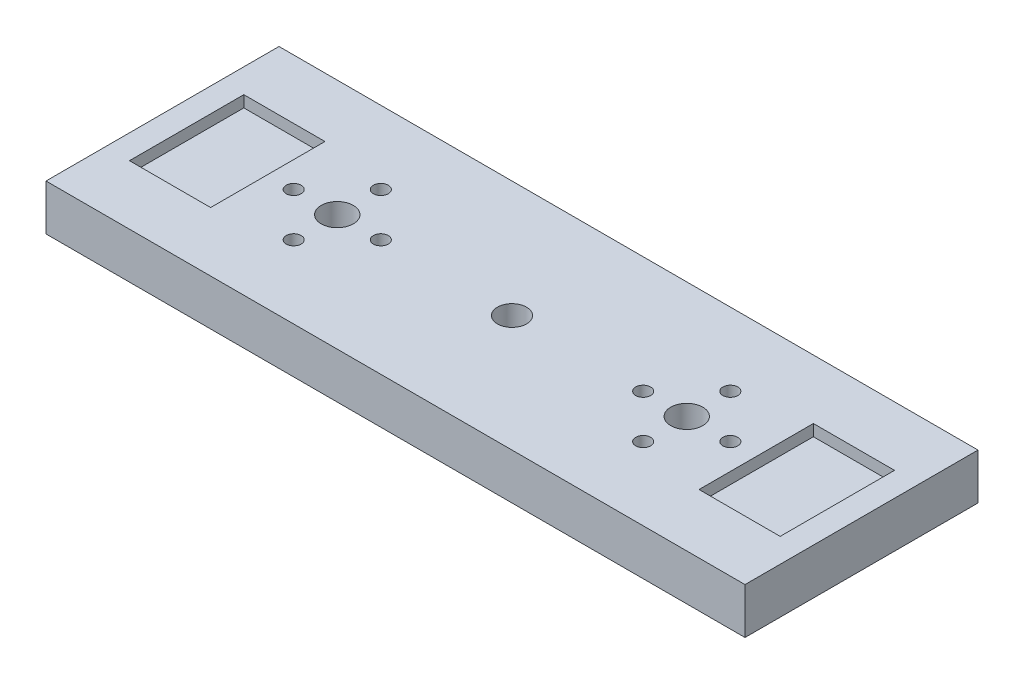
from build123d import *

# Parameters (mm, degrees)
SKETCH2_W                 = 304.8
SKETCH2_H                 = 101.6
SKETCH2_R                 = 6.35
SKETCH2_R_2               = 7
BOSS_EXTRUDE1_DEPTH       = 20
SKETCH3_R                 = 3.25
CUT_EXTRUDE1_DEPTH        = 162.883909021
CIRPATTERN1_COUNT         = 4
LPATTERN1_COUNT           = 2
LPATTERN1_PITCH           = 152.4
LPATTERN1_COPY_1_SKETCH_R = 3.25
LPATTERN1_COPY_1_DEPTH    = 162.883909021
LPATTERN1_COPY_2_SKETCH_R = 3.25
LPATTERN1_COPY_2_DEPTH    = 162.883909021
LPATTERN1_COPY_3_SKETCH_R = 3.25
LPATTERN1_COPY_3_DEPTH    = 162.883909021
SKETCH4_W                 = 35.387760229
SKETCH4_H                 = 49.864571232
CUT_EXTRUDE2_DEPTH        = 5


with BuildPart() as part:
    # Sketch2 → Boss-Extrude1 (new body)
    with BuildSketch(Plane(origin=(0, 0, 0), x_dir=(1, 0, 0), z_dir=(0, 1, 0))):
        Rectangle(SKETCH2_W, SKETCH2_H)
        with Locations(Location((0, 0, 0), (0, 0, 270))):
            Circle(SKETCH2_R, mode=Mode.SUBTRACT)
        with Locations(Location((-76.2, 0, 0), (0, 0, 270))):
            Circle(SKETCH2_R_2, mode=Mode.SUBTRACT)
        with Locations(Location((76.2, 0, 0), (0, 0, 270))):
            Circle(SKETCH2_R_2, mode=Mode.SUBTRACT)
    extrude(amount=BOSS_EXTRUDE1_DEPTH)

    # Sketch3 → Cut-Extrude1 (cut, through all)
    with BuildSketch(Plane(origin=(0, 20, 0), x_dir=(1, 0, 0), z_dir=(0, 1, 0))):
        with Locations(Location((-76.2, 19, 0), (0, 0, 270))):
            Circle(SKETCH3_R)
    cut_extrude1 = extrude(amount=-CUT_EXTRUDE1_DEPTH, mode=Mode.SUBTRACT)

    # CirPattern1: Cut-Extrude1 ×4 about axis
    cirpattern1_axis = Axis((-76.2, 0, 0), (0, 1, 0))
    for i in range(1, CIRPATTERN1_COUNT):
        add(cut_extrude1.rotate(cirpattern1_axis, i * 360 / CIRPATTERN1_COUNT), mode=Mode.SUBTRACT)

    # LPattern1: Cut-Extrude1 ×2
    with Locations(*[(i * LPATTERN1_PITCH, 0, 0) for i in range(1, LPATTERN1_COUNT)]):
        add(cut_extrude1, mode=Mode.SUBTRACT)

    # LPattern1 copy 1 sketch → LPattern1 copy 1 (cut, through all)
    with BuildSketch(Plane(origin=(76.2, 20, -76.2), x_dir=(0, 0, -1), z_dir=(0, 1, 0))):
        with Locations(Location((-76.2, 19, 0), (0, 0, 270))):
            Circle(LPATTERN1_COPY_1_SKETCH_R)
    extrude(amount=-LPATTERN1_COPY_1_DEPTH, mode=Mode.SUBTRACT)

    # LPattern1 copy 2 sketch → LPattern1 copy 2 (cut, through all)
    with BuildSketch(Plane(origin=(0, 20, 0), x_dir=(-1, 0, 0), z_dir=(0, 1, 0))):
        with Locations(Location((-76.2, 19, 0), (0, 0, 270))):
            Circle(LPATTERN1_COPY_2_SKETCH_R)
    extrude(amount=-LPATTERN1_COPY_2_DEPTH, mode=Mode.SUBTRACT)

    # LPattern1 copy 3 sketch → LPattern1 copy 3 (cut, through all)
    with BuildSketch(Plane(origin=(76.2, 20, 76.2), x_dir=(0, 0, 1), z_dir=(0, 1, 0))):
        with Locations(Location((-76.2, 19, 0), (0, 0, 270))):
            Circle(LPATTERN1_COPY_3_SKETCH_R)
    extrude(amount=-LPATTERN1_COPY_3_DEPTH, mode=Mode.SUBTRACT)

    # Sketch4 → Cut-Extrude2 (cut)
    with BuildSketch(Plane(origin=(0, 20, 0), x_dir=(1, 0, 0), z_dir=(0, 1, 0))):
        with Locations((-124.178867714, 0)):
            Rectangle(SKETCH4_W, SKETCH4_H)
        with Locations((124.178867714, 0)):
            Rectangle(SKETCH4_W, SKETCH4_H)
    extrude(amount=-CUT_EXTRUDE2_DEPTH, mode=Mode.SUBTRACT)


solid = part.part
